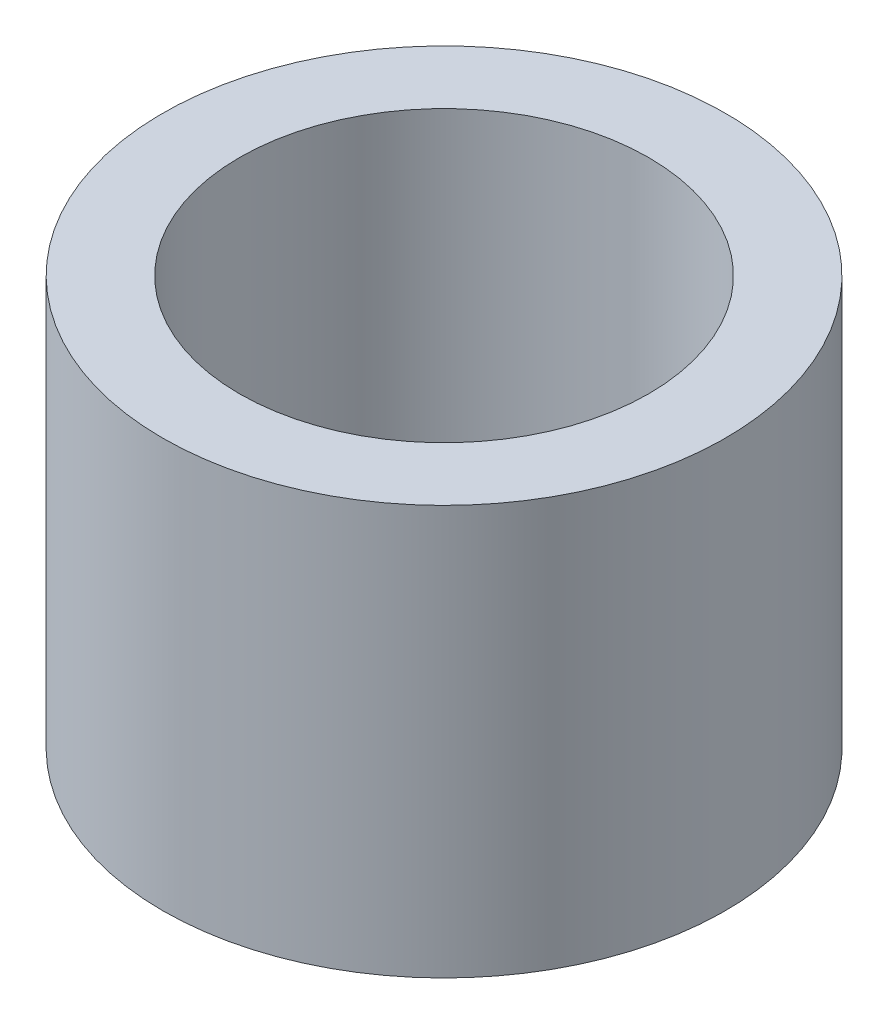
from build123d import *

# Parameters (mm, degrees)
SKETCH1_R           = 11
SKETCH1_R_2         = 8
BOSS_EXTRUDE1_DEPTH = 16


with BuildPart() as part:
    # Sketch1 → Boss-Extrude1 (new body)
    with BuildSketch(Plane(origin=(0, 0, 0), x_dir=(1, 0, 0), z_dir=(0, 1, 0))):
        with Locations(Location((0, 0, 0), (0, 0, 270))):
            Circle(SKETCH1_R)
        with Locations(Location((0, 0, 0), (0, 0, 270))):
            Circle(SKETCH1_R_2, mode=Mode.SUBTRACT)
    extrude(amount=BOSS_EXTRUDE1_DEPTH)


solid = part.part
